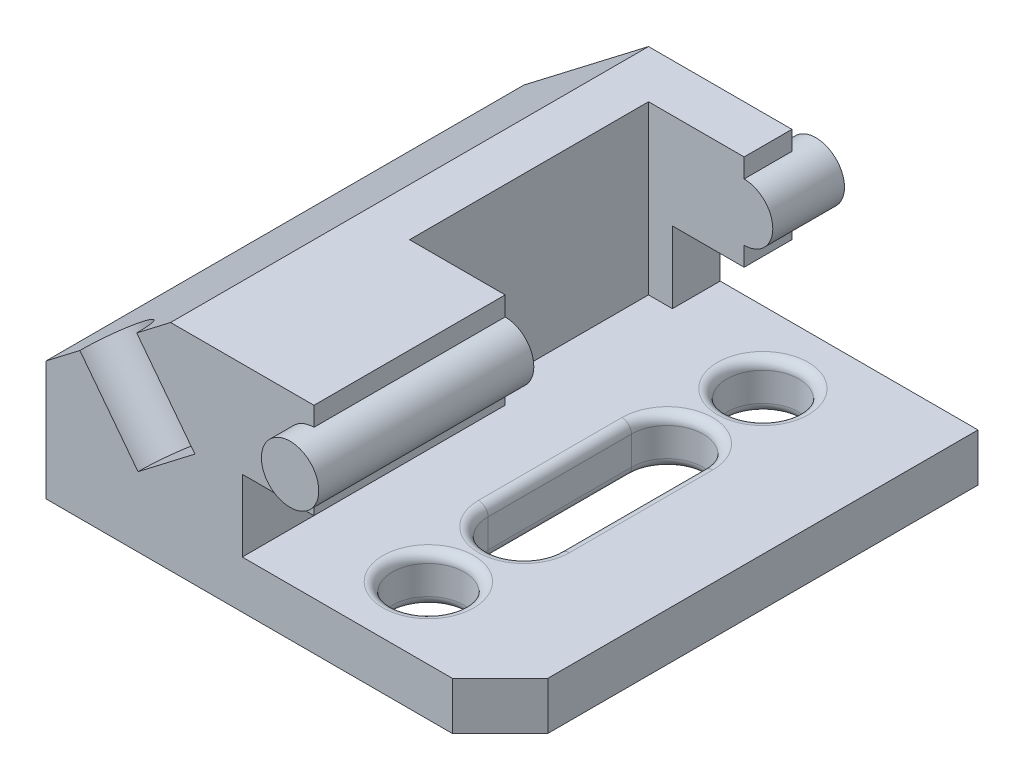
from build123d import *

# Parameters (mm, degrees)
BOSS_EXTRU_1_DEPTH      = 50
BOSS_EXTRU_2_DEPTH      = 55
BOSS_EXTRU_2_DEPTH_BACK = 55
ESQUISSE3_R             = 6
ESQUISSE4_W             = 26
ESQUISSE4_H             = 50
ENL_V_MAT_EXTRU_1_DEPTH = 35
ESQUISSE5_R             = 7.5
ENL_V_MAT_EXTRU_2_DEPTH = 20
ESQUISSE8_R             = 7.5
ENL_V_MAT_EXTRU_3_DEPTH = 116.217186218
CONG_1_R                = 2
CONG_2_R                = 2
CHANFREIN3_SIZE         = 10


with BuildPart() as part:
    # Esquisse1 → Boss.-Extru.1 (new, symmetric)
    with BuildSketch(Plane.XY):
        Polygon((0, 0), (0, 25), (26.064507457, 45), (56.064507457, 45), (56.064507457, 25), (41.064507457, 25), (41.064507457, 10), (95, 10), (95, 0), align=None)
    extrude(amount=BOSS_EXTRU_1_DEPTH, both=True)

    # Esquisse3 → Boss.-Extru.2 (add, two sides: drawn at the far end of the back side and taken through both)
    with BuildSketch(Plane.XY.offset(-BOSS_EXTRU_2_DEPTH_BACK)):
        with Locations((56.064507457, 35)):
            Circle(ESQUISSE3_R)
    extrude(amount=BOSS_EXTRU_2_DEPTH + BOSS_EXTRU_2_DEPTH_BACK)

    # Esquisse4 → Enlèv. mat.-Extru.1 (cut)
    with BuildSketch(Plane(origin=(0, 45, 0), x_dir=(1, 0, 0), z_dir=(0, 1, 0))):
        with Locations((49.064507457, 15)):
            Rectangle(ESQUISSE4_W, ESQUISSE4_H)
    extrude(amount=-ENL_V_MAT_EXTRU_1_DEPTH, mode=Mode.SUBTRACT)

    # Esquisse5 → Enlèv. mat.-Extru.2 (cut)
    with BuildSketch(Plane(origin=(-12.074072829, 15.735238064, 0), x_dir=(0.7933533402912366, 0.6087614290087189, 0), z_dir=(-0.6087614290087189, 0.7933533402912367, 0))):
        with Locations((31.645832042, -50)):
            Circle(ESQUISSE5_R)
    extrude(amount=-ENL_V_MAT_EXTRU_2_DEPTH, mode=Mode.SUBTRACT)

    # Esquisse8 → Enlèv. mat.-Extru.3 (cut, through all)
    with BuildSketch(Plane(origin=(0, 10, 0), x_dir=(1, 0, 0), z_dir=(0, 1, 0))):
        with Locations(Location((65, -35, 0), (0, 0, 180))):
            Circle(ESQUISSE8_R)
        with Locations(Location((65, 35, 0), (0, 0, 180))):
            Circle(ESQUISSE8_R)
        with BuildLine():
            Line((72.5, 15), (72.5, -15))
            ThreePointArc((72.5, -15), (65, -22.5), (57.5, -15))
            Line((57.5, -15), (57.5, 15))
            ThreePointArc((57.5, 15), (65, 22.5), (72.5, 15))
        make_face()
    extrude(amount=-ENL_V_MAT_EXTRU_3_DEPTH, mode=Mode.SUBTRACT)

    # Congé1
    cong_1_edges = [part.edges().sort_by_distance(p)[0] for p in [
        (65, 0, -22.5),
        (72.5, 0, 0),
        (65, 0, 22.5),
        (57.5, 0, 0),
        (65, 10, -22.5),
        (57.5, 10, 0),
        (65, 10, 22.5),
        (72.5, 10, 0),
    ]]
    fillet(cong_1_edges, radius=CONG_1_R)

    # Congé2
    cong_2_edges = [part.edges().sort_by_distance(p)[0] for p in [
        (72.5, 0, -35),
        (72.5, 10, -35),
        (72.5, 0, 35),
        (72.5, 10, 35),
    ]]
    fillet(cong_2_edges, radius=CONG_2_R)

    # Chanfrein3
    chanfrein3_edges = [part.edges().sort_by_distance(p)[0] for p in [
        (95, 5, 50),
    ]]
    chamfer(chanfrein3_edges, length=CHANFREIN3_SIZE)


solid = part.part
